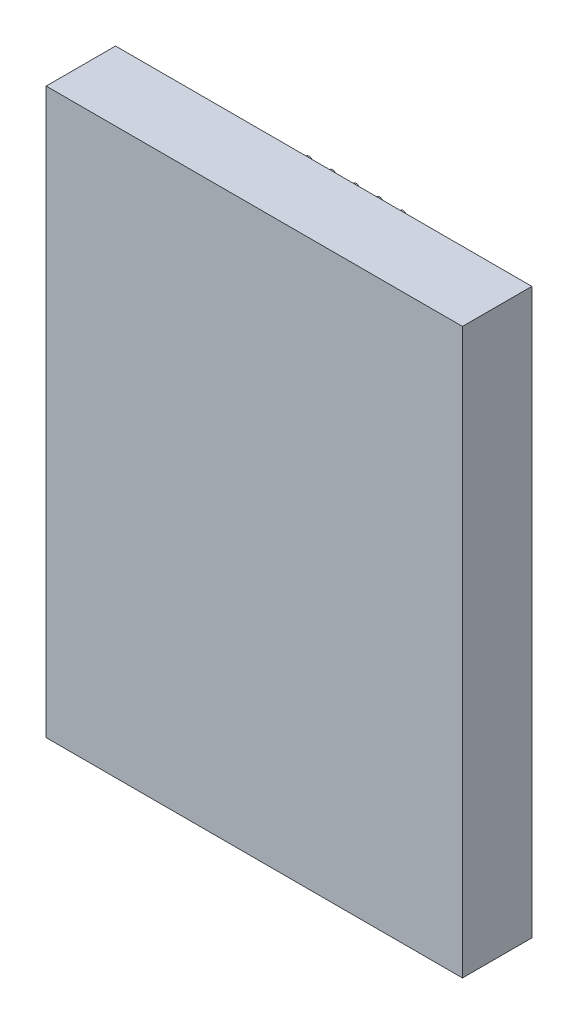
from build123d import *

# Parameters (mm, degrees)
CROQUIS1_W              = 90
CROQUIS1_H              = 122
SALIENTE_EXTRUIR1_DEPTH = 15
CROQUIS2_R              = 0.8
SALIENTE_EXTRUIR2_DEPTH = 7


with BuildPart() as part:
    # Croquis1 → Saliente-Extruir1 (new body)
    with BuildSketch(Plane.XY):
        Rectangle(CROQUIS1_W, CROQUIS1_H)
    extrude(amount=SALIENTE_EXTRUIR1_DEPTH)

    # Croquis2 → Saliente-Extruir2 (add)
    with BuildSketch(Plane.XY):
        with Locations((10.16, -53.5)):
            Circle(CROQUIS2_R)
        with Locations((10.16, 53.5)):
            Circle(CROQUIS2_R)
        with Locations((5.08, -53.5)):
            Circle(CROQUIS2_R)
        with Locations((5.08, 53.5)):
            Circle(CROQUIS2_R)
        with Locations((0, -53.5)):
            Circle(CROQUIS2_R)
        with Locations((0, 53.5)):
            Circle(CROQUIS2_R)
        with Locations((-5.08, -53.5)):
            Circle(CROQUIS2_R)
        with Locations((-5.08, 53.5)):
            Circle(CROQUIS2_R)
        with Locations((-10.16, -53.5)):
            Circle(CROQUIS2_R)
        with Locations((-10.16, 53.5)):
            Circle(CROQUIS2_R)
    extrude(amount=-SALIENTE_EXTRUIR2_DEPTH)


solid = part.part
